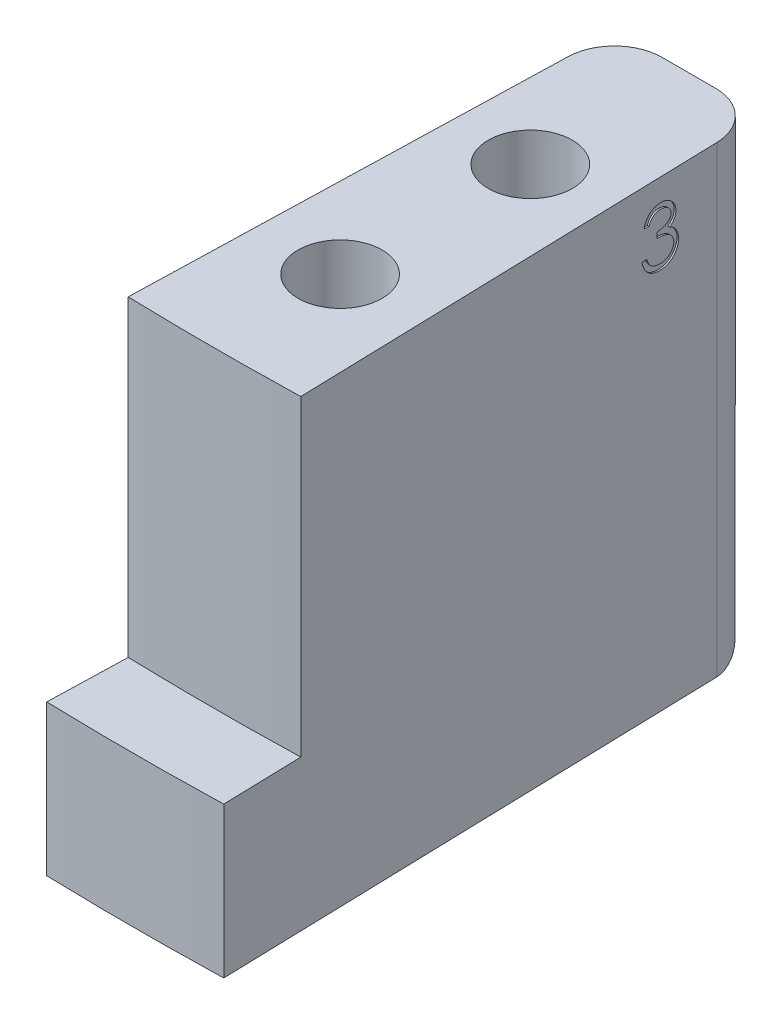
from build123d import *

# Parameters (mm, degrees)
EXTRUDE_590_DEPTH   = 29.2
EXTRUDE_638_DEPTH   = 9.5
FILLET_1_R          = 3
HOLE_WIZARD_M5_1_D  = 5.3
CUT_EXTRUDE_1_DEPTH = 5
CUT_EXTRUDE_2_DEPTH = 0.1


with BuildPart() as part:
    # 草图1 → Extrude 590 (new body)
    with BuildSketch(Plane(origin=(0, 0, 0), x_dir=(1, 0, 0), z_dir=(0, 1, 0))):
        with BuildLine():
            Line((4.608867317, -165), (-4.608867317, -165))
            Line((-4.608867317, -165), (-5.444719551, -194.923972433))
            ThreePointArc((-5.444719551, -194.923972433), (0, -195), (5.444719551, -194.923972433))
            Line((5.444719551, -194.923972433), (4.608867317, -165))
        make_face()
    extrude(amount=EXTRUDE_590_DEPTH)

    # 草图1<3> → Extrude 638 (add)
    with BuildSketch(Plane(origin=(0, 0, 0), x_dir=(1, 0, 0), z_dir=(0, 1, 0))):
        with BuildLine():
            ThreePointArc((5.444719551, -194.923972433), (0, -195), (-5.444719551, -194.923972433))
            Line((-5.444719551, -194.923972433), (-5.584327745, -199.922023008))
            ThreePointArc((-5.584327745, -199.922023008), (0, -200), (5.584327745, -199.922023008))
            Line((5.584327745, -199.922023008), (5.444719551, -194.923972433))
        make_face()
    extrude(amount=EXTRUDE_638_DEPTH)

    # 圆角1
    fillet_1_edges = [part.edges().sort_by_distance(p)[0] for p in [
        (4.608867317, 14.6, 165),
        (0, 0, 165),
        (-4.608867317, 14.6, 165),
    ]]
    fillet(fillet_1_edges, radius=FILLET_1_R)

    # M5 间隙孔1 (through all)
    with Locations(Plane(origin=(0, 29.2, 0), x_dir=(1, 0, 0), z_dir=(0, 1, 0))):
        with Locations((0, -187), (0, -175)):
            Hole(HOLE_WIZARD_M5_1_D / 2)

    # 草图6 → 切除-拉伸1 (cut)
    with BuildSketch(Plane.XZ):
        Polygon((0, 179.792007234), (-4.15, 177.396003617), (-4.15, 172.603996383), (0, 170.207992766), (4.15, 172.603996383), (4.15, 177.396003617), align=None)
        Polygon((0, 191.792007234), (-4.15, 189.396003617), (-4.15, 184.603996383), (0, 182.207992766), (4.15, 184.603996383), (4.15, 189.396003617), align=None)
    extrude(amount=-CUT_EXTRUDE_1_DEPTH, mode=Mode.SUBTRACT)

    # 草图7 → 切除-拉伸2 (cut)
    with BuildSketch(Plane(origin=(0, 0, 0), x_dir=(-0.02792163872356911, 0, -0.9996101150403545), z_dir=(0.9996101150403545, 0, -0.02792163872356911))):
        with BuildLine():
            Line((-172.3983953, 26.892307692), (-172.712497864, 26.892307692))
            add(Edge.make_bspline(
                [(-172.712497864, 26.892307692), (-172.703988313, 26.927540176), (-172.687352838, 26.996416801), (-172.652655264, 27.094824062), (-172.614856009, 27.187947583), (-172.569466905, 27.274043657), (-172.51995815, 27.354842559), (-172.463235429, 27.428511684), (-172.401915706, 27.496924649), (-172.334090757, 27.557637887), (-172.262962095, 27.612615616), (-172.187527476, 27.659490673), (-172.109304582, 27.699814826), (-172.027751449, 27.733035058), (-171.942625277, 27.758060582), (-171.854695654, 27.776217387), (-171.763732154, 27.788008502), (-171.701984563, 27.789159265), (-171.670630877, 27.78974359)],
                knots=[0, 0, 0, 0, 1.162005537, 2.271625781, 3.343758855, 4.383309926, 5.390229558, 6.379919256, 7.361854164, 8.333198761, 9.295911338, 10.242430842, 11.177959212, 12.116337295, 13.062827104, 14.020064771, 14.994644689, 16, 16, 16, 16], degree=3))
            add(Edge.make_bspline(
                [(-171.670630877, 27.78974359), (-171.624948135, 27.788364359), (-171.534579124, 27.785635984), (-171.401816077, 27.760721548), (-171.273789258, 27.721296415), (-171.15190001, 27.666822688), (-171.038681577, 27.599635375), (-170.937945391, 27.519670638), (-170.85105688, 27.428471337), (-170.778162502, 27.327738772), (-170.721087503, 27.220083263), (-170.67900113, 27.109283106), (-170.653379449, 26.995601134), (-170.650058892, 26.918843855), (-170.6483953, 26.880388622)],
                knots=[0, 0, 0, 0, 1.083050992, 2.142477498, 3.193116406, 4.255571735, 5.30263384, 6.308962982, 7.297363603, 8.282367274, 9.249857812, 10.179914175, 11.08814088, 12, 12, 12, 12], degree=3))
            add(Edge.make_bspline(
                [(-170.6483953, 26.880388622), (-170.649558891, 26.843381827), (-170.651835858, 26.770965273), (-170.671169564, 26.665243775), (-170.703705827, 26.565602175), (-170.748775589, 26.471621013), (-170.807117139, 26.383896173), (-170.877789836, 26.302230282), (-170.961292498, 26.226261124), (-171.024571436, 26.182741651), (-171.057149306, 26.160336538)],
                knots=[0, 0, 0, 0, 1.024540389, 2.004866551, 2.965041327, 3.920577974, 4.882998113, 5.874504559, 6.905732034, 8, 8, 8, 8], degree=3))
            add(Edge.make_bspline(
                [(-171.057149306, 26.160336538), (-171.019917552, 26.142358367), (-170.946150678, 26.106738409), (-170.845600148, 26.036882652), (-170.754322273, 25.956226304), (-170.703418554, 25.893283652), (-170.677842415, 25.861658654)],
                knots=[0, 0, 0, 0, 1.015518401, 2.012035669, 3.001164323, 4, 4, 4, 4], degree=3))
            add(Edge.make_bspline(
                [(-170.677842415, 25.861658654), (-170.661001073, 25.838600902), (-170.627594177, 25.792862986), (-170.586358643, 25.71932656), (-170.548949529, 25.644975071), (-170.51979931, 25.567815664), (-170.497225443, 25.488742651), (-170.48108941, 25.407620255), (-170.47106527, 25.324382232), (-170.469629718, 25.268069752), (-170.46890812, 25.239763622)],
                knots=[0, 0, 0, 0, 1.025084078, 2.033381695, 3.024893161, 4.013698104, 4.991890475, 5.976764909, 6.982997093, 8, 8, 8, 8], degree=3))
            add(Edge.make_bspline(
                [(-170.46890812, 25.239763622), (-170.470702634, 25.190753901), (-170.474283216, 25.092965099), (-170.50628729, 24.948490377), (-170.555900531, 24.807264875), (-170.626357467, 24.672190036), (-170.712224976, 24.545809655), (-170.8143823, 24.432733346), (-170.931668708, 24.335534741), (-171.062474357, 24.254324513), (-171.204191486, 24.189406591), (-171.355767078, 24.144349148), (-171.515017132, 24.115003148), (-171.624224429, 24.11185628), (-171.67974546, 24.11025641)],
                knots=[0, 0, 0, 0, 0.955779014, 1.907060117, 2.875433937, 3.871313158, 4.872415639, 5.851225146, 6.836215519, 7.83643374, 8.849228613, 9.86973379, 10.916971861, 12, 12, 12, 12], degree=3))
            add(Edge.make_bspline(
                [(-171.67974546, 24.11025641), (-171.717164761, 24.111124624), (-171.790793466, 24.112832978), (-171.899036964, 24.124511579), (-172.002358663, 24.145841584), (-172.100898261, 24.174544889), (-172.194743298, 24.210936632), (-172.283607403, 24.25625533), (-172.368037296, 24.309566832), (-172.447236247, 24.371500419), (-172.521194815, 24.440781759), (-172.587947539, 24.518640769), (-172.648607332, 24.603638173), (-172.701549971, 24.696761229), (-172.749186924, 24.796806487), (-172.78836788, 24.905054985), (-172.822853449, 25.020539007), (-172.838886913, 25.101016747), (-172.847113249, 25.142307692)],
                knots=[0, 0, 0, 0, 1.048658725, 2.063410685, 3.046034179, 4.001477787, 4.936774919, 5.862367409, 6.792675028, 7.730719943, 8.675894397, 9.627829632, 10.600096036, 11.597688215, 12.626045268, 13.701542398, 14.82072376, 16, 16, 16, 16], degree=3))
            Line((-172.847113249, 25.142307692), (-172.533010685, 25.142307692))
            add(Edge.make_bspline(
                [(-172.533010685, 25.142307692), (-172.524827393, 25.115358679), (-172.508910181, 25.062940507), (-172.481815882, 24.987500202), (-172.45094761, 24.918342149), (-172.417833052, 24.854959027), (-172.383054606, 24.796726624), (-172.344139681, 24.745184755), (-172.303970535, 24.698069553), (-172.273691182, 24.671524941), (-172.258872063, 24.658533654)],
                knots=[0, 0, 0, 0, 1.198163088, 2.33053128, 3.407730985, 4.417276592, 5.372219308, 6.28897303, 7.162600585, 8, 8, 8, 8], degree=3))
            add(Edge.make_bspline(
                [(-172.258872063, 24.658533654), (-172.239275486, 24.64342532), (-172.200142823, 24.613255288), (-172.136374592, 24.57475366), (-172.069309706, 24.541392634), (-171.997495032, 24.515908939), (-171.922480262, 24.494331278), (-171.843052896, 24.480210759), (-171.759913679, 24.470522587), (-171.703145916, 24.469667656), (-171.674136486, 24.469230769)],
                knots=[0, 0, 0, 0, 0.946170439, 1.889420265, 2.845303464, 3.807233317, 4.801018734, 5.828864929, 6.890507805, 8, 8, 8, 8], degree=3))
            add(Edge.make_bspline(
                [(-171.674136486, 24.469230769), (-171.641382983, 24.469846674), (-171.577336336, 24.471051024), (-171.483881477, 24.482126731), (-171.394974029, 24.498257144), (-171.311601104, 24.523170127), (-171.232670596, 24.553950979), (-171.159288947, 24.592599384), (-171.09049284, 24.637944106), (-171.027163435, 24.689483264), (-170.970217928, 24.745904759), (-170.920078414, 24.80491783), (-170.877453753, 24.86627366), (-170.843070175, 24.930311781), (-170.815919624, 24.99676701), (-170.797436424, 25.065825839), (-170.784584909, 25.136923105), (-170.783538296, 25.185252074), (-170.783010685, 25.209615385)],
                knots=[0, 0, 0, 0, 1.217147791, 2.380027433, 3.494444702, 4.572153297, 5.609568379, 6.639424714, 7.649109417, 8.668170816, 9.669597737, 10.625200337, 11.543417969, 12.441394052, 13.322311151, 14.205496177, 15.095365482, 16, 16, 16, 16], degree=3))
            add(Edge.make_bspline(
                [(-170.783010685, 25.209615385), (-170.784540986, 25.242226723), (-170.787593975, 25.307287132), (-170.810902554, 25.403004706), (-170.849241418, 25.495228118), (-170.90291393, 25.582383909), (-170.968249658, 25.66315981), (-171.044614565, 25.735231293), (-171.132642793, 25.794701384), (-171.213662662, 25.83579004), (-171.285427819, 25.863827115), (-171.346843203, 25.88250208), (-171.415599807, 25.898315735), (-171.490866156, 25.913028007), (-171.573209372, 25.925549355), (-171.66253981, 25.935991171), (-171.758875572, 25.944346212), (-171.825566738, 25.948077307), (-171.859933762, 25.95)],
                knots=[0, 0, 0, 0, 1.07054697, 2.135767047, 3.216561865, 4.33974944, 5.486079747, 6.621378074, 7.775625952, 8.963672916, 9.598146892, 10.304877434, 11.070270905, 11.915000392, 12.823868403, 13.805723172, 14.86925407, 16, 16, 16, 16], degree=3))
            Line((-171.859933762, 25.95), (-171.859933762, 26.308974359))
            add(Edge.make_bspline(
                [(-171.859933762, 26.308974359), (-171.816632596, 26.309709163), (-171.731816249, 26.311148463), (-171.607921944, 26.328556473), (-171.489448632, 26.352637101), (-171.37902189, 26.389522293), (-171.278373177, 26.43236259), (-171.191053575, 26.4822148), (-171.118286428, 26.537629549), (-171.060425356, 26.599462158), (-171.016896128, 26.665777206), (-170.98506933, 26.734893864), (-170.966269004, 26.807417924), (-170.963759337, 26.856912592), (-170.962497864, 26.881790865)],
                knots=[0, 0, 0, 0, 1.321986639, 2.589447074, 3.816329219, 5.01088745, 6.139805852, 7.153945165, 8.075214402, 8.924034688, 9.728124013, 10.488707548, 11.240355623, 12, 12, 12, 12], degree=3))
            add(Edge.make_bspline(
                [(-170.962497864, 26.881790865), (-170.962912275, 26.900068611), (-170.963736726, 26.936431318), (-170.974134004, 26.989556386), (-170.989758045, 27.041057332), (-171.011237774, 27.090715142), (-171.039987973, 27.138185416), (-171.074393959, 27.183872865), (-171.11536206, 27.227516644), (-171.162307507, 27.268196964), (-171.212719312, 27.306966201), (-171.267969087, 27.339879838), (-171.326390961, 27.3680249), (-171.388049616, 27.391234402), (-171.453145146, 27.40869369), (-171.521371704, 27.421229532), (-171.592859388, 27.429067187), (-171.64163112, 27.430195602), (-171.666424146, 27.430769231)],
                knots=[0, 0, 0, 0, 0.884392785, 1.759457502, 2.611959086, 3.489218968, 4.37281399, 5.2945488, 6.255912374, 7.266815255, 8.301784654, 9.332968512, 10.37626691, 11.440494194, 12.520033166, 13.637162961, 14.798855837, 16, 16, 16, 16], degree=3))
            add(Edge.make_bspline(
                [(-171.666424146, 27.430769231), (-171.706275814, 27.429377869), (-171.784115391, 27.426660215), (-171.896330307, 27.402857202), (-172.000649641, 27.364879118), (-172.080388308, 27.319546099), (-172.139270882, 27.274795665), (-172.18134782, 27.235713279), (-172.222668331, 27.192280455), (-172.260514008, 27.14182208), (-172.298787984, 27.087755289), (-172.333632546, 27.027331608), (-172.367492238, 26.962127214), (-172.387894788, 26.916031579), (-172.3983953, 26.892307692)],
                knots=[0, 0, 0, 0, 1.472543308, 2.876219568, 4.221790263, 5.565193594, 6.249813518, 6.953379497, 7.687249741, 8.463570142, 9.283606569, 10.136032583, 11.040678096, 12, 12, 12, 12], degree=3))
        make_face()
    extrude(amount=-CUT_EXTRUDE_2_DEPTH, mode=Mode.SUBTRACT)


solid = part.part
